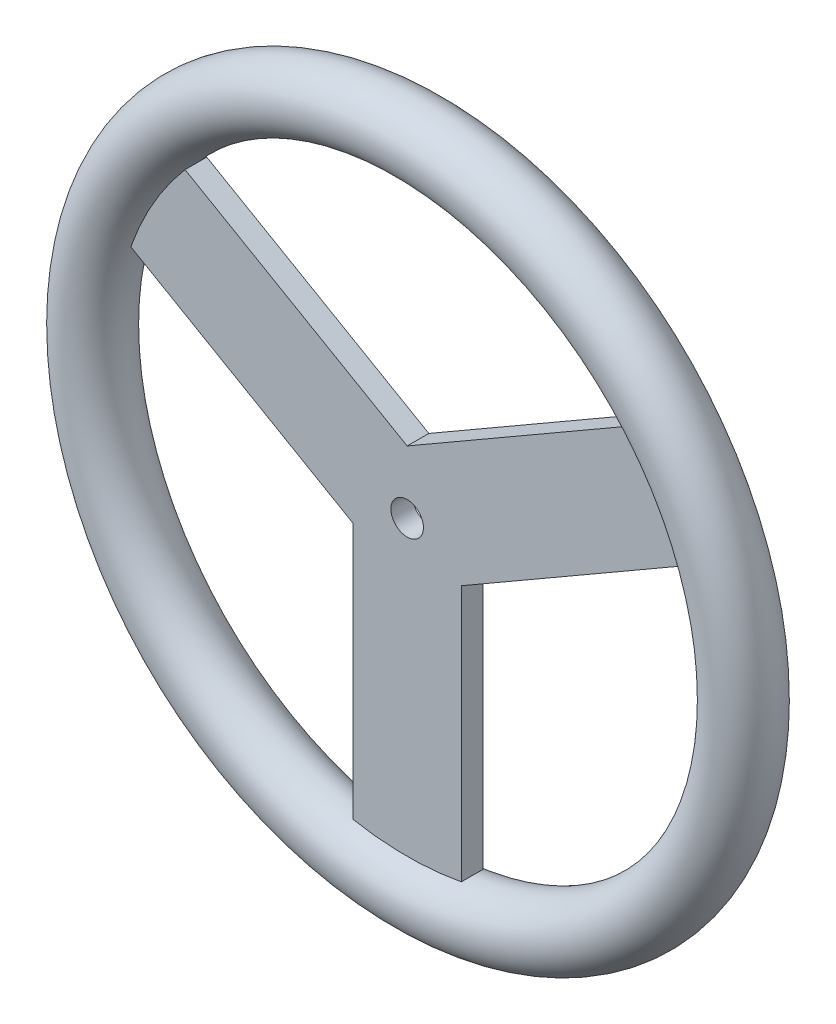
from build123d import *

# Parameters (mm, degrees)
IZIM3_R                          = 15
Y_KSEKLIK_EKSTR_ZYON1_DEPTH      = 5
Y_KSEKLIK_EKSTR_ZYON1_DEPTH_BACK = 5
KES_EKSTR_ZYON1_DEPTH            = 128
KES_EKSTR_ZYON1_DEPTH_BACK       = 201
IZIM6_R                          = 7.5


with BuildPart() as part:
    # Süpür2: sweep along a path in Çizim1
    with BuildLine(Plane.XY) as s_p_r2_path:
        ThreePointArc((150, 0), (0, 150), (-150, 0))
    # Çizim3 → Süpür2 (sweep)
    with BuildSketch(Plane(origin=(0, 0, 0), x_dir=(1, 0, 0), z_dir=(0, 1, 0))):
        with Locations((-150, 0)):
            Circle(IZIM3_R)
    s_p_r2 = sweep(path=s_p_r2_path.line)

    # Aynalama1: Süpür2 across plane
    add(s_p_r2.mirror(Plane(origin=(150, 0, 0), x_dir=(0, 0, 1), z_dir=(0, -1, 0))))


with BuildPart() as body_2:
    # Çizim5 → Yükseklik-Ekstrüzyon1 (new, two sides: drawn at the far end of the back side and taken through both)
    with BuildSketch(Plane.XY.offset(-Y_KSEKLIK_EKSTR_ZYON1_DEPTH_BACK)):
        with BuildLine():
            Line((-102.391252931, 87.983130902), (0, 28.867513459))
            Line((0, 28.867513459), (102.391252931, 87.983130902))
            ThreePointArc((102.391252931, 87.983130902), (116.913429511, 67.5), (127.391252931, 44.681860712))
            Line((127.391252931, 44.681860712), (25, -14.43375673))
            Line((25, -14.43375673), (25, -132.664991614))
            ThreePointArc((25, -132.664991614), (0, -135), (-25, -132.664991614))
            Line((-25, -132.664991614), (-25, -14.43375673))
            Line((-25, -14.43375673), (-127.391252931, 44.681860712))
            ThreePointArc((-127.391252931, 44.681860712), (-116.913429511, 67.5), (-102.391252931, 87.983130902))
        make_face()
    extrude(amount=Y_KSEKLIK_EKSTR_ZYON1_DEPTH + Y_KSEKLIK_EKSTR_ZYON1_DEPTH_BACK)

    # Çizim6 → Kes-Ekstrüzyon1 (cut, two sides: drawn at the far end of the back side and taken through both)
    with BuildSketch(Plane.XY.offset(5).offset(-KES_EKSTR_ZYON1_DEPTH_BACK)):
        Circle(IZIM6_R)
    extrude(amount=KES_EKSTR_ZYON1_DEPTH + KES_EKSTR_ZYON1_DEPTH_BACK, mode=Mode.SUBTRACT)


solid = Compound([part.part, body_2.part])
